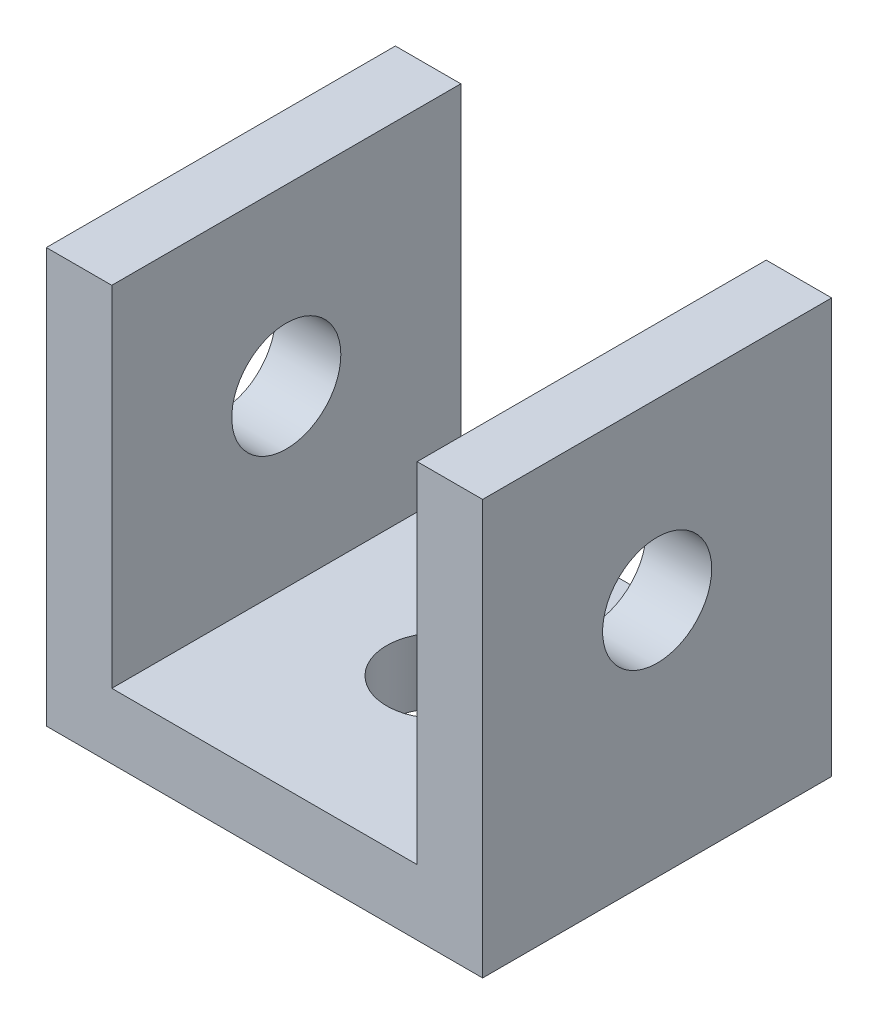
from build123d import *

# Parameters (mm, degrees)
SKETCH1_W           = 10
SKETCH1_H           = 8
BOSS_EXTRUDE1_DEPTH = 1.5
SKETCH2_W           = 1.5
SKETCH2_H           = 8
BOSS_EXTRUDE2_DEPTH = 8
SKETCH4_R           = 1.25
CUT_EXTRUDE1_DEPTH  = 14.360389216
SKETCH5_R           = 1.2
CUT_EXTRUDE2_DEPTH  = 12.456439237


with BuildPart() as part:
    # Sketch1 → Boss-Extrude1 (new body)
    with BuildSketch(Plane(origin=(0, 0, 0), x_dir=(1, 0, 0), z_dir=(0, 1, 0))):
        Rectangle(SKETCH1_W, SKETCH1_H)
    extrude(amount=BOSS_EXTRUDE1_DEPTH)

    # Sketch2 → Boss-Extrude2 (add)
    with BuildSketch(Plane(origin=(0, 1.5, 0), x_dir=(1, 0, 0), z_dir=(0, 1, 0))):
        with Locations((-4.25, 0)):
            Rectangle(SKETCH2_W, SKETCH2_H)
    boss_extrude2 = extrude(amount=BOSS_EXTRUDE2_DEPTH)

    # Sketch4 → Cut-Extrude1 (cut, through all)
    with BuildSketch(Plane(origin=(-3.5, 0, 0), x_dir=(0, 0, -1), z_dir=(1, 0, 0))):
        with Locations((0, 5.5)):
            Circle(SKETCH4_R)
    cut_extrude1 = extrude(amount=-CUT_EXTRUDE1_DEPTH, mode=Mode.SUBTRACT)

    # Mirror2: Boss-Extrude2, Cut-Extrude1 across plane
    add(boss_extrude2.mirror(Plane(origin=(0, 0, 0), x_dir=(0, 0, 1), z_dir=(1, 0, 0))))
    add(cut_extrude1.mirror(Plane(origin=(0, 0, 0), x_dir=(0, 0, 1), z_dir=(1, 0, 0))), mode=Mode.SUBTRACT)

    # Sketch5 → Cut-Extrude2 (cut, through all)
    with BuildSketch(Plane(origin=(0, 0, 0), x_dir=(1, 0, 0), z_dir=(0, 1, 0))):
        with Locations(Location((0, 0, 0), (0, 0, 90))):
            Circle(SKETCH5_R)
    extrude(amount=CUT_EXTRUDE2_DEPTH, mode=Mode.SUBTRACT)


solid = part.part
